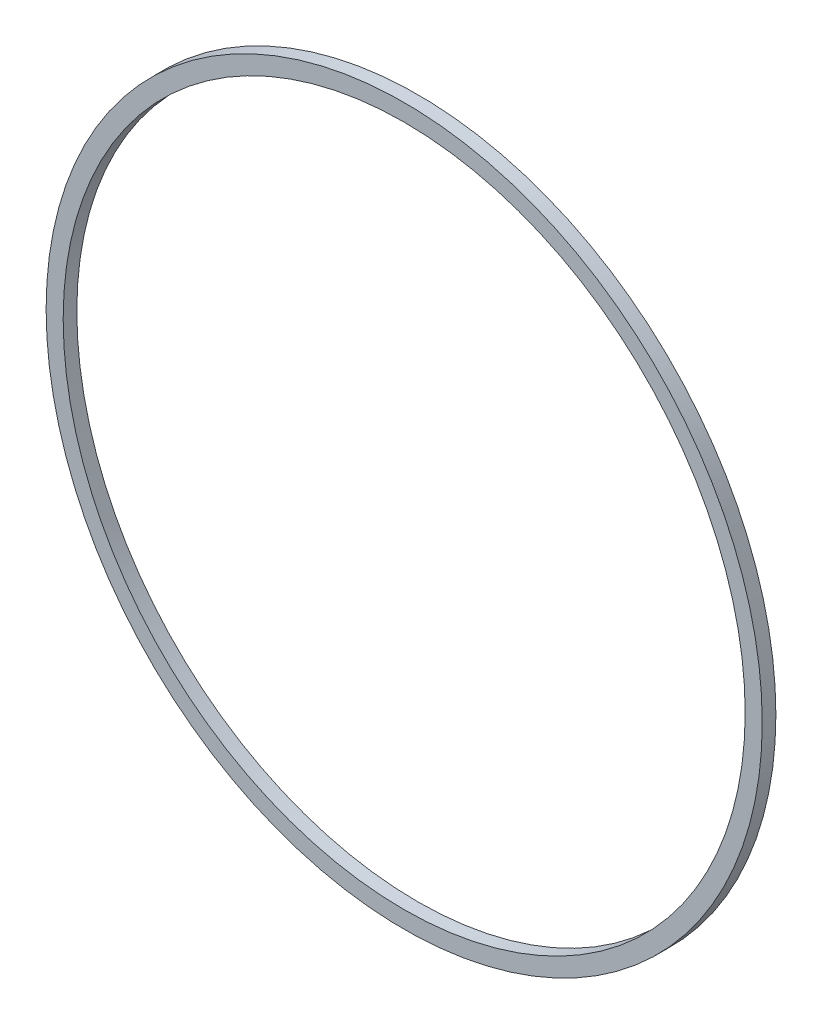
from build123d import *

# Parameters (mm, degrees)
SKETCH1_R           = 52.5
SKETCH1_R_2         = 50
BOSS_EXTRUDE1_DEPTH = 2


with BuildPart() as part:
    # Sketch1 → Boss-Extrude1 (new body)
    with BuildSketch(Plane.XY):
        Circle(SKETCH1_R)
        Circle(SKETCH1_R_2, mode=Mode.SUBTRACT)
    extrude(amount=BOSS_EXTRUDE1_DEPTH)


solid = part.part
